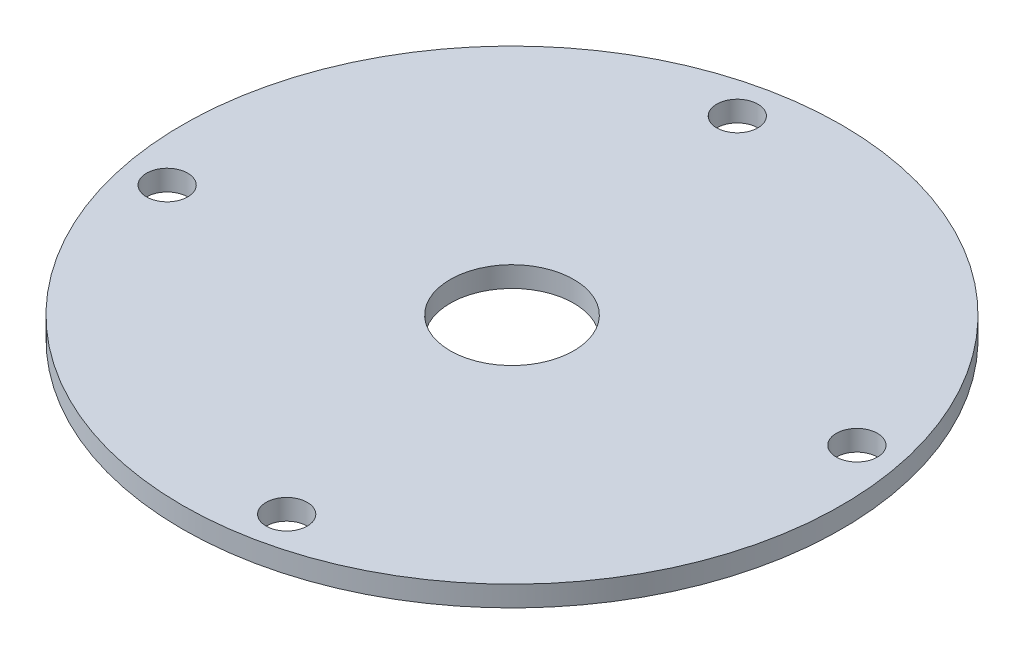
from build123d import *

# Parameters (mm, degrees)
SKETCH1_R           = 50.8
SKETCH1_R_2         = 9.525
BOSS_EXTRUDE1_DEPTH = 3.175
SKETCH2_R           = 3.175
CUT_EXTRUDE1_DEPTH  = 3.175


with BuildPart() as part:
    # Sketch1 → Boss-Extrude1 (new body)
    with BuildSketch(Plane(origin=(0, 0, 0), x_dir=(1, 0, 0), z_dir=(0, 1, 0))):
        Circle(SKETCH1_R)
        Circle(SKETCH1_R_2, mode=Mode.SUBTRACT)
    extrude(amount=BOSS_EXTRUDE1_DEPTH)

    # Sketch2 → Cut-Extrude1 (cut)
    with BuildSketch(Plane(origin=(0, 3.175, 0), x_dir=(1, 0, 0), z_dir=(0, 1, 0))):
        with Locations((-9.214642662, 43.945595463)):
            Circle(SKETCH2_R)
        with Locations((43.945595463, 9.214642662)):
            Circle(SKETCH2_R)
        with Locations((9.214642662, -43.945595463)):
            Circle(SKETCH2_R)
        with Locations((-43.945595463, -9.214642662)):
            Circle(SKETCH2_R)
    extrude(amount=-CUT_EXTRUDE1_DEPTH, mode=Mode.SUBTRACT)


solid = part.part
